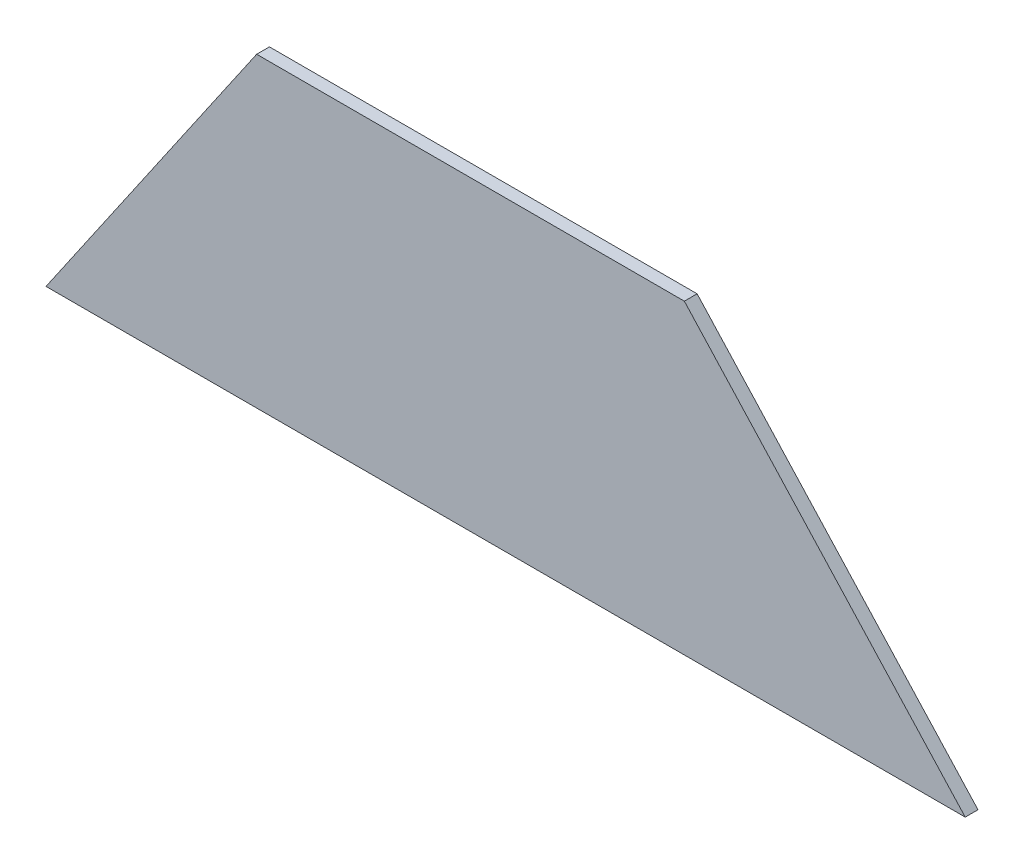
from build123d import *

# Parameters (mm, degrees)
BOSS_EXTRUDE1_DEPTH = 1.5875


with BuildPart() as part:
    # Sketch2 → Boss-Extrude1 (new body)
    with BuildSketch(Plane.XY):
        Polygon((0, 0), (114.3, 0), (79.375, 38.1), (26.19375, 38.1), align=None)
    extrude(amount=BOSS_EXTRUDE1_DEPTH)


solid = part.part
